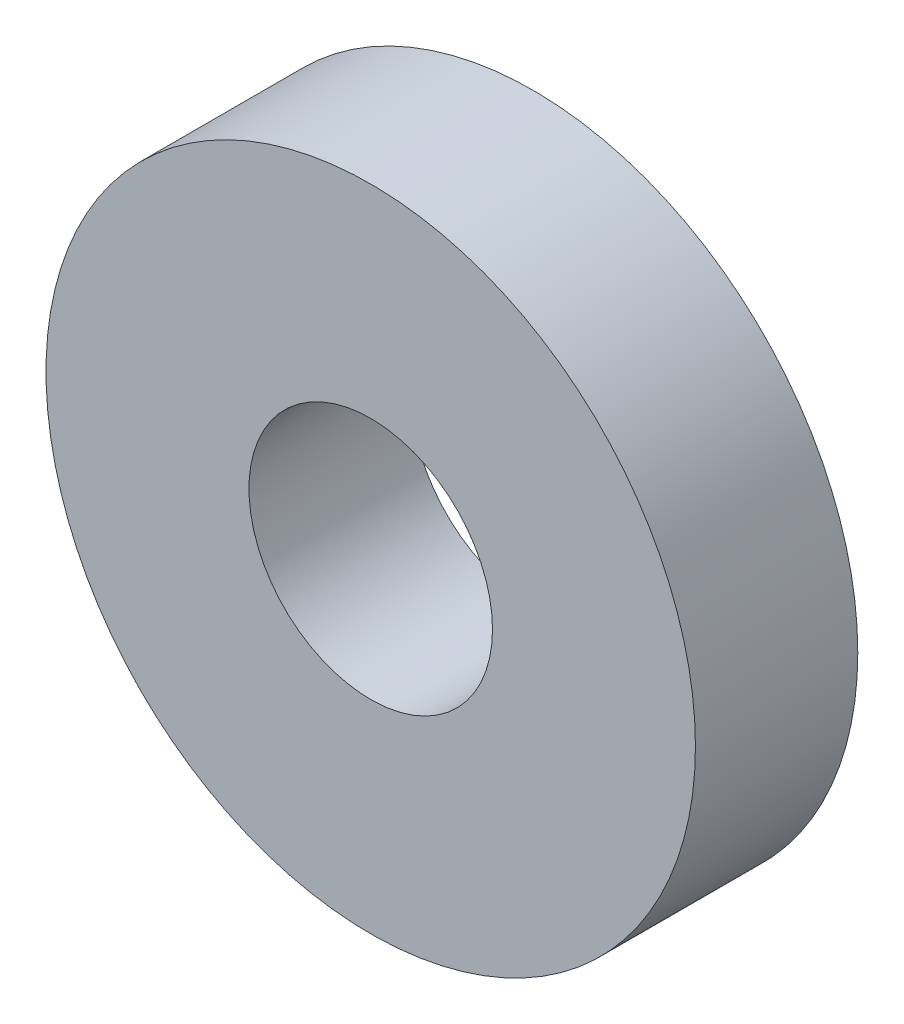
from build123d import *

# Parameters (mm, degrees)
SKETCH_8_R      = 40
SKETCH_8_R_2    = 15
EXTRUDE_1_DEPTH = 20


with BuildPart() as part:
    # 草图8 → 凸台-拉伸1 (new body)
    with BuildSketch(Plane.XY):
        Circle(SKETCH_8_R)
        Circle(SKETCH_8_R_2, mode=Mode.SUBTRACT)
    extrude(amount=EXTRUDE_1_DEPTH)


solid = part.part
